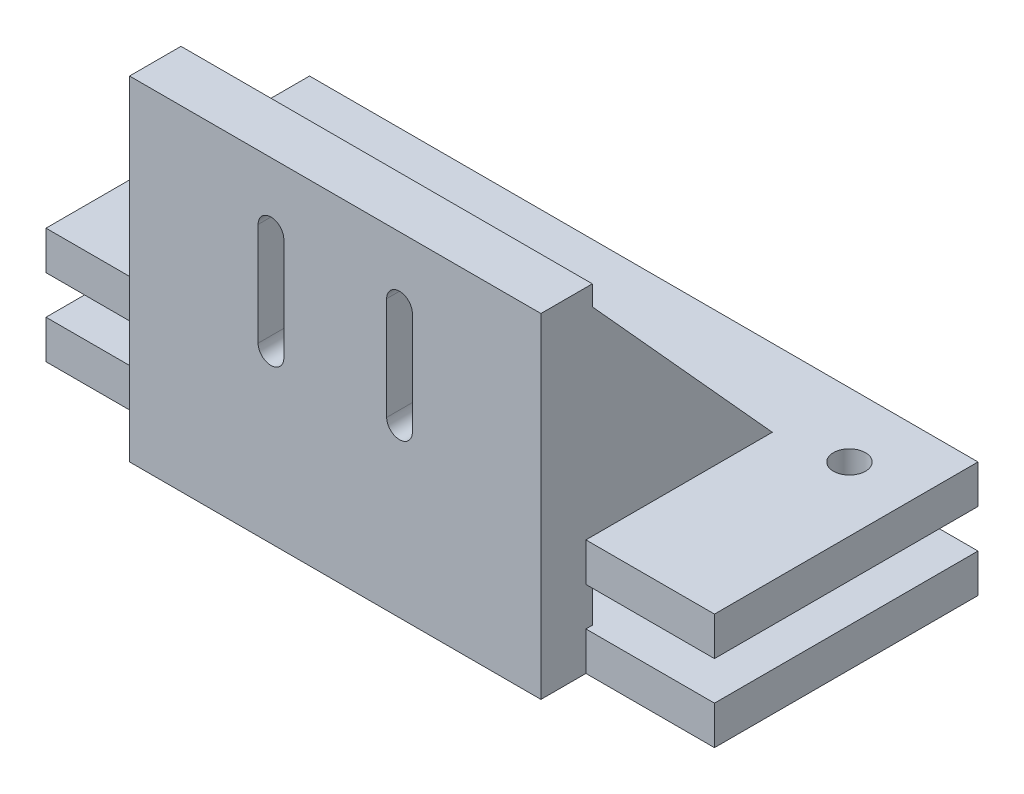
from build123d import *

# Parameters (mm, degrees)
SKETCH_1_W             = 64
SKETCH_1_H             = 52
EXTRUDE_348_DEPTH      = 8
EXTRUDE_START          = -40
SKETCH_2_W             = 104
SKETCH_2_H             = 6
EXTRUDE_C_6_DEPTH      = 41
SKETCH_3_W             = 104
SKETCH_3_H             = 6
EXTRUDE_C_6_2_DEPTH    = 41
EXTRUDE_START_2        = -32
EXTRUDE_798_DEPTH      = 6
EXTRUDE_START_3        = 26
EXTRUDE_5_DEPTH        = 6
CUT_EXTRUDE_8_DEPTH    = 8
CUT_EXTRUDE_START      = -11.5
SKETCH_7_R             = 2.5
CUT_EXTRUDE_1237_DEPTH = 18


with BuildPart() as part:
    # 草图1 → Extrude 348 (new body)
    with BuildSketch(Plane.XY):
        with Locations((0, 14.5)):
            Rectangle(SKETCH_1_W, SKETCH_1_H)
    extrude(amount=EXTRUDE_348_DEPTH)

    # 草图2 → Extrude C_6 (add)
    with BuildSketch(Plane.XY.offset(EXTRUDE_START)):
        with Locations((0, -8.5)):
            Rectangle(SKETCH_2_W, SKETCH_2_H)
    extrude(amount=EXTRUDE_C_6_DEPTH)

    # 草图3 → Extrude C_6 2 (add)
    with BuildSketch(Plane.XY.offset(EXTRUDE_START)):
        with Locations((0, 3.5)):
            Rectangle(SKETCH_3_W, SKETCH_3_H)
    extrude(amount=EXTRUDE_C_6_2_DEPTH)

    # 草图4 → Extrude 798 (add)
    with BuildSketch(Plane(origin=(0, 0, 0), x_dir=(0, 0, -1), z_dir=(1, 0, 0)).offset(EXTRUDE_START_2)):
        Polygon((28, 6.5), (-1, 6.5), (-1, 38.5), align=None)
    extrude(amount=EXTRUDE_798_DEPTH)

    # 草图5 → 凸台-拉伸5 (add)
    with BuildSketch(Plane(origin=(0, 0, 0), x_dir=(0, 0, -1), z_dir=(1, 0, 0)).offset(EXTRUDE_START_3)):
        Polygon((28, 6.5), (-1, 6.5), (-1, 38.5), align=None)
    extrude(amount=EXTRUDE_5_DEPTH)

    # 草图6 → 上下可调槽_中心行程正负8 (cut)
    with BuildSketch(Plane.XY):
        with BuildLine():
            Line((-8, 14.5), (-8, 30.5))
            ThreePointArc((-8, 30.5), (-10, 32.5), (-12, 30.5))
            Line((-12, 30.5), (-12, 14.5))
            ThreePointArc((-12, 14.5), (-10, 12.5), (-8, 14.5))
        make_face()
        with BuildLine():
            Line((12, 14.5), (12, 30.5))
            ThreePointArc((12, 30.5), (10, 32.5), (8, 30.5))
            Line((8, 30.5), (8, 14.5))
            ThreePointArc((8, 14.5), (10, 12.5), (12, 14.5))
        make_face()
    extrude(amount=CUT_EXTRUDE_8_DEPTH, mode=Mode.SUBTRACT)

    # 草图7 → Cut-Extrude 1237 (cut)
    with BuildSketch(Plane(origin=(0, 0, 0), x_dir=(1, 0, 0), z_dir=(0, 1, 0)).offset(CUT_EXTRUDE_START)):
        with Locations(Location((-42, 30, 0), (0, 0, 270))):
            Circle(SKETCH_7_R)
        with Locations(Location((42, 30, 0), (0, 0, 270))):
            Circle(SKETCH_7_R)
    extrude(amount=CUT_EXTRUDE_1237_DEPTH, mode=Mode.SUBTRACT)


solid = part.part
